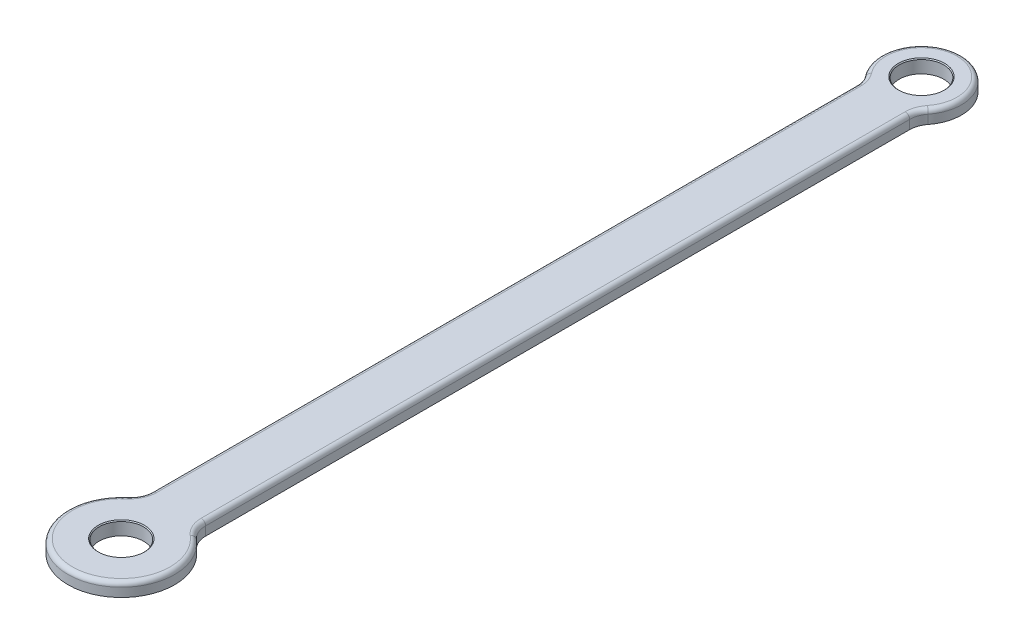
from build123d import *

# Parameters (mm, degrees)
SKETCH_1_R      = 3.333333333
EXTRUDE_1_DEPTH = 2
SCALE_1_SCALE   = 1.5
CHAMFER_1_SIZE  = 0.2
FILLET_1_R      = 5
FILLET_2_R      = 1


with BuildPart() as part:
    # 草图1 → 凸台-拉伸1 (new body)
    with BuildSketch(Plane(origin=(0, 0, 0), x_dir=(1, 0, 0), z_dir=(0, 1, 0))):
        with BuildLine():
            Line((-4, -4.472135955), (-4, -113.07179677))
            ThreePointArc((-4, -113.07179677), (0, -128), (4, -113.07179677))
            Line((4, -113.07179677), (4, -4.472135955))
            ThreePointArc((4, -4.472135955), (0, 6), (-4, -4.472135955))
        make_face()
        with Locations(Location((0, 0, 0), (0, 0, 270))):
            Circle(SKETCH_1_R, mode=Mode.SUBTRACT)
        with Locations(Location((0, -120, 0), (0, 0, 270))):
            Circle(SKETCH_1_R, mode=Mode.SUBTRACT)
    extrude(amount=EXTRUDE_1_DEPTH)


with BuildPart() as part_1:
    # 缩放比例1: scaled about (0, 1, 63.97284267)
    add(part.part.scale(SCALE_1_SCALE).moved(Location((0, -0.5, -31.986421335))))

    # 倒角1
    chamfer_1_edges = [part_1.edges().sort_by_distance(p)[0] for p in [
        (0, 2.5, -36.986421335),
        (0, 2.5, 143.013578665),
    ]]
    chamfer(chamfer_1_edges, length=CHAMFER_1_SIZE)

    # 圆角1
    fillet_1_edges = [part_1.edges().sort_by_distance(p)[0] for p in [
        (6, 1, -25.278217403),
        (6, 1, 137.62127382),
        (-6, 1, 137.62127382),
        (-6, 1, -25.278217403),
    ]]
    fillet(fillet_1_edges, radius=FILLET_1_R)

    # 圆角2
    fillet_2_edges = [part_1.edges().sort_by_distance(p)[0] for p in [
        (6, 2.5, 55.862964986),
        (0, 2.5, 160.013578665),
        (-6, 2.5, 55.862964986),
        (0, 2.5, -40.986421335),
        (6.462573935, 2.5, 137.152517394),
        (-6.462573935, 2.5, 137.152517394),
        (-6.275444087, 2.5, -24.962801474),
        (6.275444087, 2.5, -24.962801474),
    ]]
    fillet(fillet_2_edges, radius=FILLET_2_R)


solid = part_1.part
